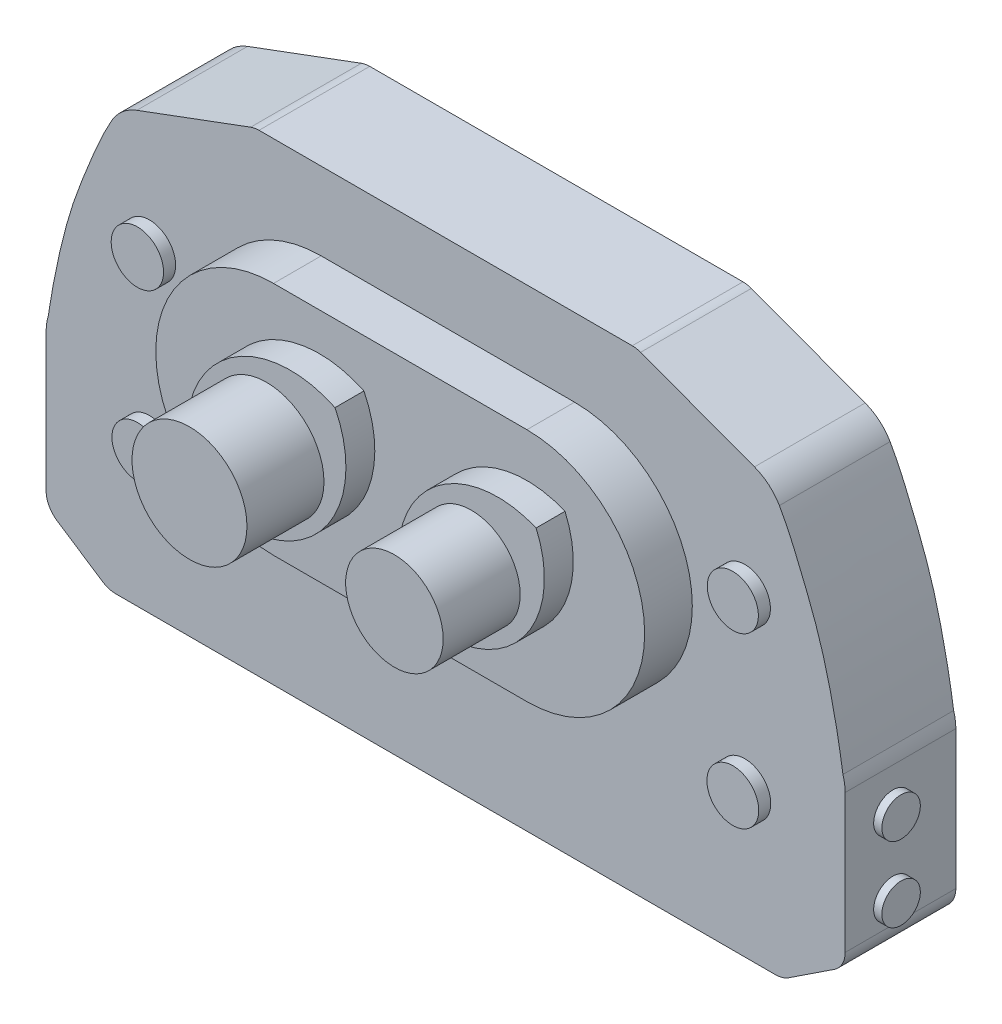
from build123d import *

# Parameters (mm, degrees)
BOSS_EXTRUDE1_DEPTH = 23
SKETCH5_R           = 4
BOSS_EXTRUDE3_DEPTH = 1.7
SKETCH8_R           = 4
BOSS_EXTRUDE4_DEPTH = 1.7
SKETCH12_R          = 5.309585237
SKETCH12_R_2        = 5.383577716
SKETCH12_R_3        = 5.290961271
SKETCH12_R_4        = 5.444301549
BOSS_EXTRUDE5_DEPTH = 9.9
BOSS_EXTRUDE6_DEPTH = 22
CUT_EXTRUDE1_START  = -16
SKETCH16_R          = 11.94
CUT_EXTRUDE1_DEPTH  = 16
CUT_EXTRUDE2_START  = -16
SKETCH17_R          = 10.13
CUT_EXTRUDE2_DEPTH  = 16
CUT_EXTRUDE3_START  = -7.4
SKETCH18_R          = 5.309585237
CUT_EXTRUDE3_DEPTH  = 7.4
CUT_EXTRUDE4_START  = -7.4
SKETCH19_R          = 5.383577716
CUT_EXTRUDE4_DEPTH  = 7.4
CUT_EXTRUDE5_START  = -7.4
SKETCH20_R          = 5.444301549
CUT_EXTRUDE5_DEPTH  = 7.4
CUT_EXTRUDE6_START  = -7.4
SKETCH21_R          = 5.290961271
CUT_EXTRUDE6_DEPTH  = 7.4


with BuildPart() as part:
    # Sketch2 → Boss-Extrude1 (new body)
    with BuildSketch(Plane.XY):
        with BuildLine():
            Line((70.523413182, -121.258597495), (80.001788964, -115.008475165))
            ThreePointArc((80.001788964, -115.008475165), (81.651709385, -113.204688447), (82.249297777, -110.834293536))
            Line((82.249297777, -110.834293536), (82.249297777, -82.060728072))
            ThreePointArc((82.249297777, -82.060728072), (82.132627635, -80.537642087), (81.785339594, -79.050095835))
            add(Edge.make_bspline(
                [(81.785339594, -79.050095835), (81.779550585, -79.03175941), (79.763594577, -64.21980724), (72.310783114, -44.632084365), (70.089271073, -39.87053002), (68.584818962, -37.26596578)],
                knots=[0.01010668, 0.01010668, 0.01010668, 0.01010668, 0.430228508, 0.512694162, 0.834763224, 0.834763224, 0.834763224, 0.834763224], degree=3))
            ThreePointArc((68.584818962, -37.26596578), (66.377835563, -34.627803803), (63.407507036, -32.893496223))
            Line((63.407507036, -32.893496223), (39.759590264, -24.109812278))
            ThreePointArc((39.759590264, -24.109812278), (38.90305511, -23.875770322), (38.018627658, -23.796927511))
            Line((38.018627658, -23.796927511), (-39.520032104, -23.796927511))
            ThreePointArc((-39.520032104, -23.796927511), (-40.404459556, -23.875770322), (-41.26099471, -24.109812278))
            Line((-41.26099471, -24.109812278), (-64.908911482, -32.893496223))
            ThreePointArc((-64.908911482, -32.893496223), (-67.879240009, -34.627803803), (-70.086223408, -37.26596578))
            add(Edge.make_bspline(
                [(-83.28674404, -79.050095835), (-83.280955031, -79.03175941), (-81.264999023, -64.21980724), (-73.81218756, -44.632084365), (-71.590675519, -39.87053002), (-70.086223408, -37.26596578)],
                knots=[0.01010668, 0.01010668, 0.01010668, 0.01010668, 0.430228508, 0.512694162, 0.834763224, 0.834763224, 0.834763224, 0.834763224], degree=3))
            ThreePointArc((-83.28674404, -79.050095835), (-83.634032081, -80.537642087), (-83.750702223, -82.060728072))
            Line((-83.750702223, -82.060728072), (-83.750702223, -110.834293536))
            ThreePointArc((-83.750702223, -110.834293536), (-83.153113831, -113.204688447), (-81.50319341, -115.008475165))
            Line((-81.50319341, -115.008475165), (-72.024817629, -121.258597495))
            ThreePointArc((-72.024817629, -121.258597495), (-70.709179228, -121.873513284), (-69.272326442, -122.084415867))
            Line((-69.272326442, -122.084415867), (67.770921996, -122.084415867))
            ThreePointArc((67.770921996, -122.084415867), (69.207774782, -121.873513284), (70.523413182, -121.258597495))
        make_face()
    extrude(amount=BOSS_EXTRUDE1_DEPTH)

    # Sketch5 → Boss-Extrude3 (add)
    with BuildSketch(Plane.ZY.offset(83.750702223)):
        with Locations(Location((13.083649818, -90.551709518, 0), (0, 0, 90))):
            Circle(SKETCH5_R)
        with Locations(Location((13.083649818, -106.069633318, 0), (0, 0, 90))):
            Circle(SKETCH5_R)
    extrude(amount=BOSS_EXTRUDE3_DEPTH)

    # Sketch8 → Boss-Extrude4 (add)
    with BuildSketch(Plane(origin=(82.249297777, 0, 0), x_dir=(0, 0, -1), z_dir=(1, 0, 0))):
        with Locations(Location((-13.08, -90.550728072, 0), (0, 0, 270))):
            Circle(SKETCH8_R)
        with Locations(Location((-13.08, -106.070728072, 0), (0, 0, 270))):
            Circle(SKETCH8_R)
    extrude(amount=BOSS_EXTRUDE4_DEPTH)

    # Sketch12 → Boss-Extrude5 (add)
    with BuildSketch(Plane.XY.offset(23)):
        with Locations(Location((61.412858859, -56.74856372, 0), (0, 0, 180))):
            Circle(SKETCH12_R)
        with Locations(Location((61.412858859, -91.784557501, 0), (0, 0, 180))):
            Circle(SKETCH12_R_2)
        with Locations(Location((-62.293922582, -91.784557501, 0), (0, 0, 180))):
            Circle(SKETCH12_R_3)
        with Locations(Location((-62.293922582, -56.74856372, 0), (0, 0, 180))):
            Circle(SKETCH12_R_4)
        with BuildLine():
            Line((26.03317791, -39.941081705), (-26.605656617, -39.941081705))
            ThreePointArc((-26.605656617, -39.941081705), (-51.069934746, -64.405359834), (-26.605656617, -88.869637962))
            Line((-26.605656617, -88.869637962), (26.03317791, -88.869637962))
            ThreePointArc((26.03317791, -88.869637962), (50.497456038, -64.405359834), (26.03317791, -39.941081705))
        make_face()
    extrude(amount=BOSS_EXTRUDE5_DEPTH)

    # Sketch15 → Boss-Extrude6 (add)
    with BuildSketch(Plane.XY.offset(32.9)):
        with BuildLine():
            ThreePointArc((-36.30694092, -78.897586955), (-32.416918561, -54.237740907), (-7.831564022, -49.901772358))
            ThreePointArc((-7.831564022, -49.901772358), (-11.721586381, -74.561618406), (-36.30694092, -78.897586955))
        make_face()
        with BuildLine():
            ThreePointArc((33.947027157, -50.665986501), (29.727203797, -73.404384895), (7.056950152, -77.976175614))
            ThreePointArc((7.056950152, -77.976175614), (11.276773512, -55.23777722), (33.947027157, -50.665986501))
        make_face()
    extrude(amount=BOSS_EXTRUDE6_DEPTH)

    # Sketch16 → Cut-Extrude1 (cut)
    with BuildSketch(Plane.XY.offset(54.9).offset(CUT_EXTRUDE1_START)):
        with BuildLine():
            ThreePointArc((-36.30694092, -78.897586955), (-32.416918561, -54.237740907), (-7.831564022, -49.901772358))
            ThreePointArc((-7.831564022, -49.901772358), (-11.721586381, -74.561618406), (-36.30694092, -78.897586955))
        make_face()
        with Locations((-22.069252471, -64.399679657)):
            Circle(SKETCH16_R, mode=Mode.SUBTRACT)
    extrude(amount=CUT_EXTRUDE1_DEPTH, mode=Mode.SUBTRACT)

    # Sketch17 → Cut-Extrude2 (cut)
    with BuildSketch(Plane.XY.offset(54.9).offset(CUT_EXTRUDE2_START)):
        with BuildLine():
            ThreePointArc((7.056950152, -77.976175614), (11.276773512, -55.23777722), (33.947027157, -50.665986501))
            ThreePointArc((33.947027157, -50.665986501), (29.727203797, -73.404384895), (7.056950152, -77.976175614))
        make_face()
        with Locations((20.501988655, -64.321081058)):
            Circle(SKETCH17_R, mode=Mode.SUBTRACT)
    extrude(amount=CUT_EXTRUDE2_DEPTH, mode=Mode.SUBTRACT)

    # Sketch18 → Cut-Extrude3 (cut)
    with BuildSketch(Plane.XY.offset(32.9).offset(CUT_EXTRUDE3_START)):
        with Locations(Location((61.412858859, -56.74856372, 0), (0, 0, 180))):
            Circle(SKETCH18_R)
    extrude(amount=CUT_EXTRUDE3_DEPTH, mode=Mode.SUBTRACT)

    # Sketch19 → Cut-Extrude4 (cut)
    with BuildSketch(Plane.XY.offset(32.9).offset(CUT_EXTRUDE4_START)):
        with Locations(Location((61.412858859, -91.784557501, 0), (0, 0, 180))):
            Circle(SKETCH19_R)
    extrude(amount=CUT_EXTRUDE4_DEPTH, mode=Mode.SUBTRACT)

    # Sketch20 → Cut-Extrude5 (cut)
    with BuildSketch(Plane.XY.offset(32.9).offset(CUT_EXTRUDE5_START)):
        with Locations(Location((-62.293922582, -56.74856372, 0), (0, 0, 180))):
            Circle(SKETCH20_R)
    extrude(amount=CUT_EXTRUDE5_DEPTH, mode=Mode.SUBTRACT)

    # Sketch21 → Cut-Extrude6 (cut)
    with BuildSketch(Plane.XY.offset(32.9).offset(CUT_EXTRUDE6_START)):
        with Locations(Location((-62.293922582, -91.784557501, 0), (0, 0, 180))):
            Circle(SKETCH21_R)
    extrude(amount=CUT_EXTRUDE6_DEPTH, mode=Mode.SUBTRACT)


solid = part.part
